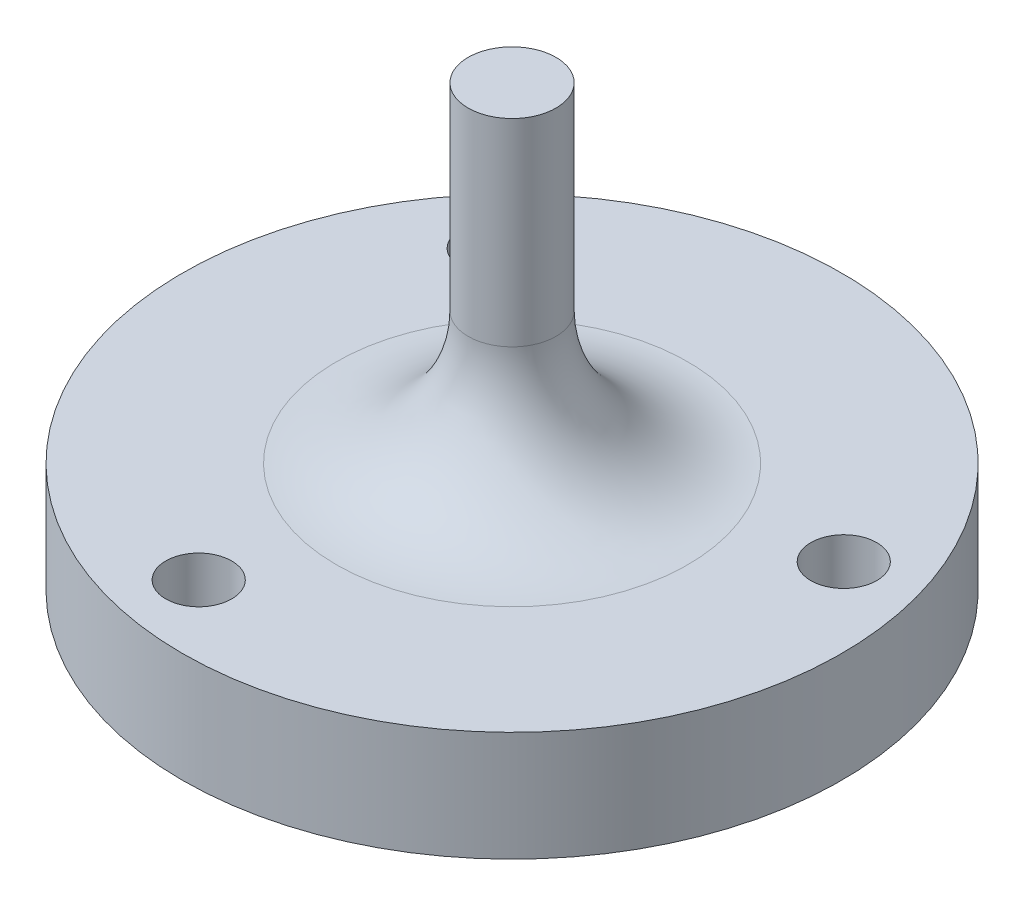
from build123d import *

# Parameters (mm, degrees)
SKETCH1_R           = 15
BOSS_EXTRUDE1_DEPTH = 5
SKETCH2_R           = 2
BOSS_EXTRUDE2_DEPTH = 15
FILLET1_R           = 6
SKETCH3_R           = 1.5
CUT_EXTRUDE1_DEPTH  = 26.980762114
CIRPATTERN1_COUNT   = 3


with BuildPart() as part:
    # Sketch1 → Boss-Extrude1 (new body)
    with BuildSketch(Plane(origin=(0, 0, 0), x_dir=(1, 0, 0), z_dir=(0, 1, 0))):
        Circle(SKETCH1_R)
    extrude(amount=BOSS_EXTRUDE1_DEPTH)

    # Sketch2 → Boss-Extrude2 (add)
    with BuildSketch(Plane(origin=(0, 5, 0), x_dir=(1, 0, 0), z_dir=(0, 1, 0))):
        Circle(SKETCH2_R)
    extrude(amount=BOSS_EXTRUDE2_DEPTH)

    # Fillet1
    fillet1_edges = [part.edges().sort_by_distance(p)[0] for p in [
        (-2, 5, 0),
    ]]
    fillet(fillet1_edges, radius=FILLET1_R)

    # Sketch3 → Cut-Extrude1 (cut, through all)
    with BuildSketch(Plane(origin=(0, 5, 0), x_dir=(1, 0, 0), z_dir=(0, 1, 0))):
        with Locations((-2.532093929, -11.72981246)):
            Circle(SKETCH3_R)
    cut_extrude1 = extrude(amount=-CUT_EXTRUDE1_DEPTH, mode=Mode.SUBTRACT)

    # CirPattern1: Cut-Extrude1 ×3 about axis
    cirpattern1_axis = Axis((0, 20, 0), (0, -1, 0))
    for i in range(1, CIRPATTERN1_COUNT):
        add(cut_extrude1.rotate(cirpattern1_axis, i * 360 / CIRPATTERN1_COUNT), mode=Mode.SUBTRACT)


solid = part.part
